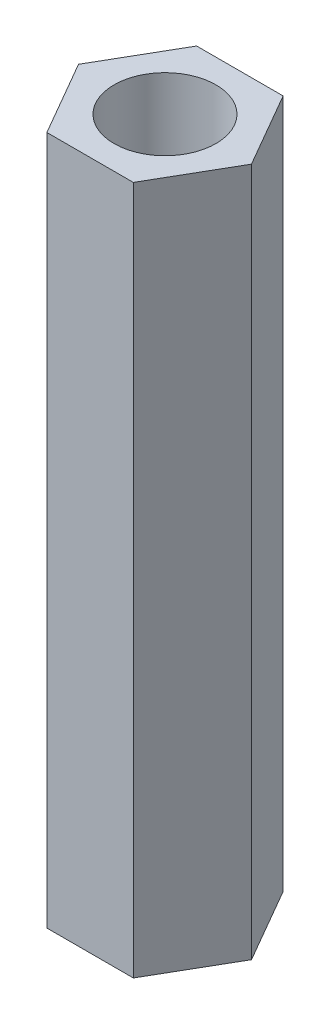
from build123d import *

# Parameters (mm, degrees)
SKETCH_1_R      = 1.7
EXTRUDE_1_DEPTH = 23


with BuildPart() as part:
    # 草图1 → 凸台-拉伸1 (new body)
    with BuildSketch(Plane(origin=(0, 0, 0), x_dir=(1, 0, 0), z_dir=(0, 1, 0))):
        Polygon((2.886751346, 0), (1.443375673, 2.5), (-1.443375673, 2.5), (-2.886751346, 0), (-1.443375673, -2.5), (1.443375673, -2.5), align=None)
        with Locations(Location((0, 0, 0), (0, 0, 270))):
            Circle(SKETCH_1_R, mode=Mode.SUBTRACT)
    extrude(amount=EXTRUDE_1_DEPTH)


solid = part.part
